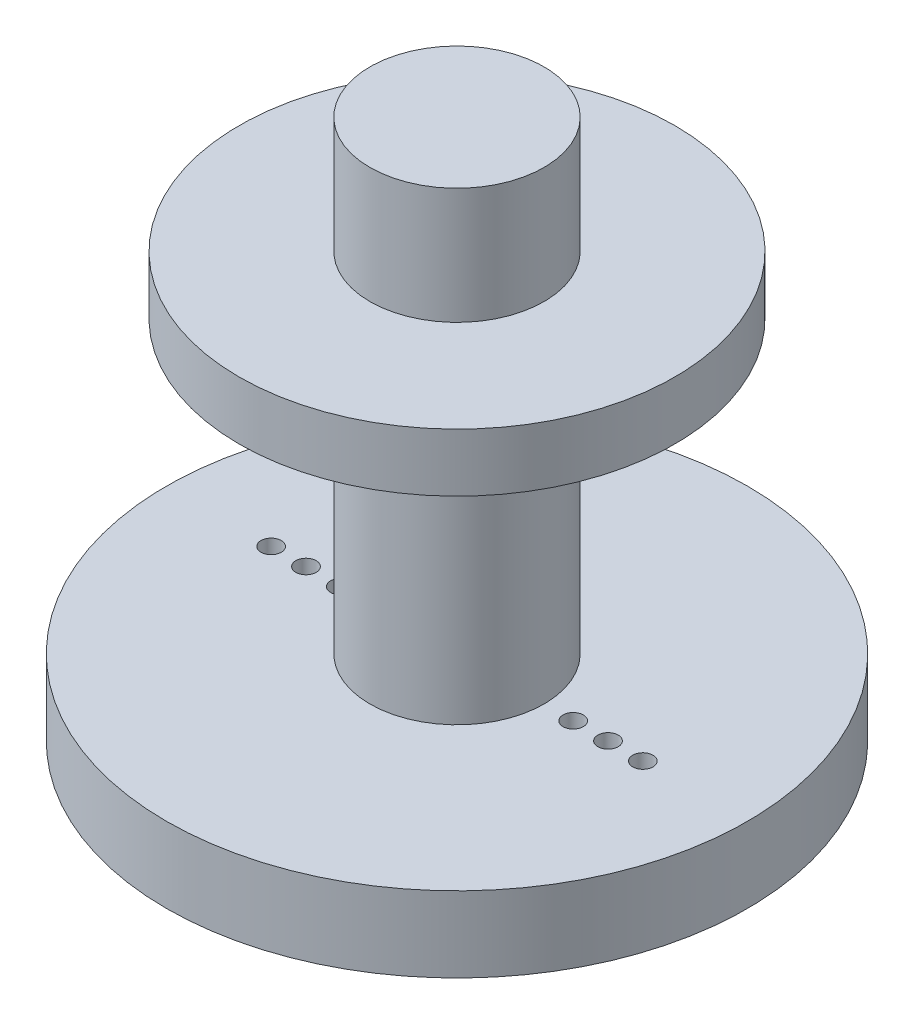
from build123d import *

# Parameters (mm, degrees)
SKETCH1_R             = 25
BOSS_EXTRUDE1_DEPTH   = 6.5
HORN_HOLE_DEPTH       = 2
SCREW_HOLES_REACH     = 37.641
SKETCH9_R             = 0.875
SKETCH11_R            = 7.5
BOSS_EXTRUDE2_DEPTH   = 25
SKETCH12_R            = 18.75
BOSS_EXTRUDE3_DEPTH   = 5
SCREW_HEAD_HOLE_ANGLE = 180
BOSS_EXTRUDE4_START   = 30
SKETCH11_2_R          = 7.5
BOSS_EXTRUDE4_DEPTH   = 10


with BuildPart() as part:
    # Sketch1 → Boss-Extrude1 (new body)
    with BuildSketch(Plane(origin=(0, 0, 0), x_dir=(1, 0, 0), z_dir=(0, 1, 0))):
        with Locations(Location((0, 0, 0), (0, 0, 90))):
            Circle(SKETCH1_R)
    extrude(amount=BOSS_EXTRUDE1_DEPTH)

    # Sketch8 → Horn Hole (cut)
    with BuildSketch(Plane.XZ):
        with BuildLine():
            ThreePointArc((2.867832451, 6.276606431), (5.55485913, 5.311303559), (8.103473198, 4.024257195))
            ThreePointArc((8.103473198, 4.024257195), (12.790122891, 3.37163327), (17.445502266, 2.524257195))
            ThreePointArc((17.445502266, 2.524257195), (19.894779582, 1.820498395), (21, -0.475742805))
            ThreePointArc((21, -0.475742805), (19.60737188, -2.167378066), (17.445502266, -2.524257195))
            ThreePointArc((17.445502266, -2.524257195), (12.790122891, -3.37163327), (8.103473198, -4.024257195))
            ThreePointArc((8.103473198, -4.024257195), (5.55485913, -5.311303559), (2.867832451, -6.276606431))
            ThreePointArc((2.867832451, -6.276606431), (0, -6.900742805), (-2.867832451, -6.276606431))
            ThreePointArc((-2.867832451, -6.276606431), (-5.55485913, -5.311303559), (-8.103473198, -4.024257195))
            ThreePointArc((-8.103473198, -4.024257195), (-12.780142502, -3.846309279), (-17.445502266, -3.475742805))
            ThreePointArc((-17.445502266, -3.475742805), (-19.894779582, -2.771984005), (-21, -0.475742805))
            ThreePointArc((-21, -0.475742805), (-19.894779582, 1.820498395), (-17.445502266, 2.524257195))
            ThreePointArc((-17.445502266, 2.524257195), (-12.790122891, 3.37163327), (-8.103473198, 4.024257195))
            ThreePointArc((-8.103473198, 4.024257195), (-5.55485913, 5.311303559), (-2.867832451, 6.276606431))
            ThreePointArc((-2.867832451, 6.276606431), (0, 6.900742805), (2.867832451, 6.276606431))
        make_face()
    extrude(amount=-HORN_HOLE_DEPTH, mode=Mode.SUBTRACT)

    # Sketch9 → Screw Holes (cut, up to next)
    with BuildSketch(Plane.XZ.offset(-2), mode=Mode.PRIVATE) as screw_holes_sk1:
        with Locations(Location((10, 0, 0), (0, 0, 270))):
            Circle(SKETCH9_R)
    screw_holes_tool1 = extrude(screw_holes_sk1.sketch, amount=-SCREW_HOLES_REACH, mode=Mode.PRIVATE) & part.part
    # Sketch9 → Screw Holes (cut, up to next)
    with BuildSketch(Plane.XZ.offset(-2), mode=Mode.PRIVATE) as screw_holes_sk2:
        with Locations(Location((13, 0, 0), (0, 0, 270))):
            Circle(SKETCH9_R)
    screw_holes_tool2 = extrude(screw_holes_sk2.sketch, amount=-SCREW_HOLES_REACH, mode=Mode.PRIVATE) & part.part
    # Sketch9 → Screw Holes (cut, up to next)
    with BuildSketch(Plane.XZ.offset(-2), mode=Mode.PRIVATE) as screw_holes_sk3:
        with Locations(Location((16, 0, 0), (0, 0, 270))):
            Circle(SKETCH9_R)
    screw_holes_tool3 = extrude(screw_holes_sk3.sketch, amount=-SCREW_HOLES_REACH, mode=Mode.PRIVATE) & part.part
    # Sketch9 → Screw Holes (cut, up to next)
    with BuildSketch(Plane.XZ.offset(-2), mode=Mode.PRIVATE) as screw_holes_sk4:
        with Locations(Location((-10, 0, 0), (0, 0, 90))):
            Circle(SKETCH9_R)
    screw_holes_tool4 = extrude(screw_holes_sk4.sketch, amount=-SCREW_HOLES_REACH, mode=Mode.PRIVATE) & part.part
    # Sketch9 → Screw Holes (cut, up to next)
    with BuildSketch(Plane.XZ.offset(-2), mode=Mode.PRIVATE) as screw_holes_sk5:
        with Locations(Location((-13, 0, 0), (0, 0, 90))):
            Circle(SKETCH9_R)
    screw_holes_tool5 = extrude(screw_holes_sk5.sketch, amount=-SCREW_HOLES_REACH, mode=Mode.PRIVATE) & part.part
    # Sketch9 → Screw Holes (cut, up to next)
    with BuildSketch(Plane.XZ.offset(-2), mode=Mode.PRIVATE) as screw_holes_sk6:
        with Locations(Location((-16, 0, 0), (0, 0, 90))):
            Circle(SKETCH9_R)
    screw_holes_tool6 = extrude(screw_holes_sk6.sketch, amount=-SCREW_HOLES_REACH, mode=Mode.PRIVATE) & part.part
    add(screw_holes_tool1.solids().sort_by_distance((10, 2, 0))[0], mode=Mode.SUBTRACT)
    add(screw_holes_tool2.solids().sort_by_distance((13, 2, 0))[0], mode=Mode.SUBTRACT)
    add(screw_holes_tool3.solids().sort_by_distance((16, 2, 0))[0], mode=Mode.SUBTRACT)
    add(screw_holes_tool4.solids().sort_by_distance((-10, 2, 0))[0], mode=Mode.SUBTRACT)
    add(screw_holes_tool5.solids().sort_by_distance((-13, 2, 0))[0], mode=Mode.SUBTRACT)
    add(screw_holes_tool6.solids().sort_by_distance((-16, 2, 0))[0], mode=Mode.SUBTRACT)

    # Sketch11 → Boss-Extrude2 (add)
    with BuildSketch(Plane(origin=(0, 6.5, 0), x_dir=(1, 0, 0), z_dir=(0, 1, 0))):
        with Locations(Location((0, 0, 0), (0, 0, 270))):
            Circle(SKETCH11_R)
    extrude(amount=BOSS_EXTRUDE2_DEPTH)

    # Sketch12 → Boss-Extrude3 (add)
    with BuildSketch(Plane(origin=(0, 31.5, 0), x_dir=(1, 0, 0), z_dir=(0, 1, 0))):
        with Locations(Location((0, 0, 0), (0, 0, 270))):
            Circle(SKETCH12_R)
    extrude(amount=BOSS_EXTRUDE3_DEPTH)

    # Sketch13 → Screw Head Hole (revolve, cut)
    with BuildSketch(Plane.XZ.offset(-2)):
        with BuildLine():
            Line((3.4, 0), (-3.4, 0))
            ThreePointArc((-3.4, 0), (0, -3.4), (3.4, 0))
        make_face()
    revolve(axis=Axis((3.4, 2, 0), (1, 0, 0)), revolution_arc=SCREW_HEAD_HOLE_ANGLE, mode=Mode.SUBTRACT)

    # Sketch11<2> → Boss-Extrude4 (add)
    with BuildSketch(Plane(origin=(0, 6.5, 0), x_dir=(1, 0, 0), z_dir=(0, 1, 0)).offset(BOSS_EXTRUDE4_START)):
        with Locations(Location((0, 0, 0), (0, 0, 270))):
            Circle(SKETCH11_2_R)
    extrude(amount=BOSS_EXTRUDE4_DEPTH)


solid = part.part
